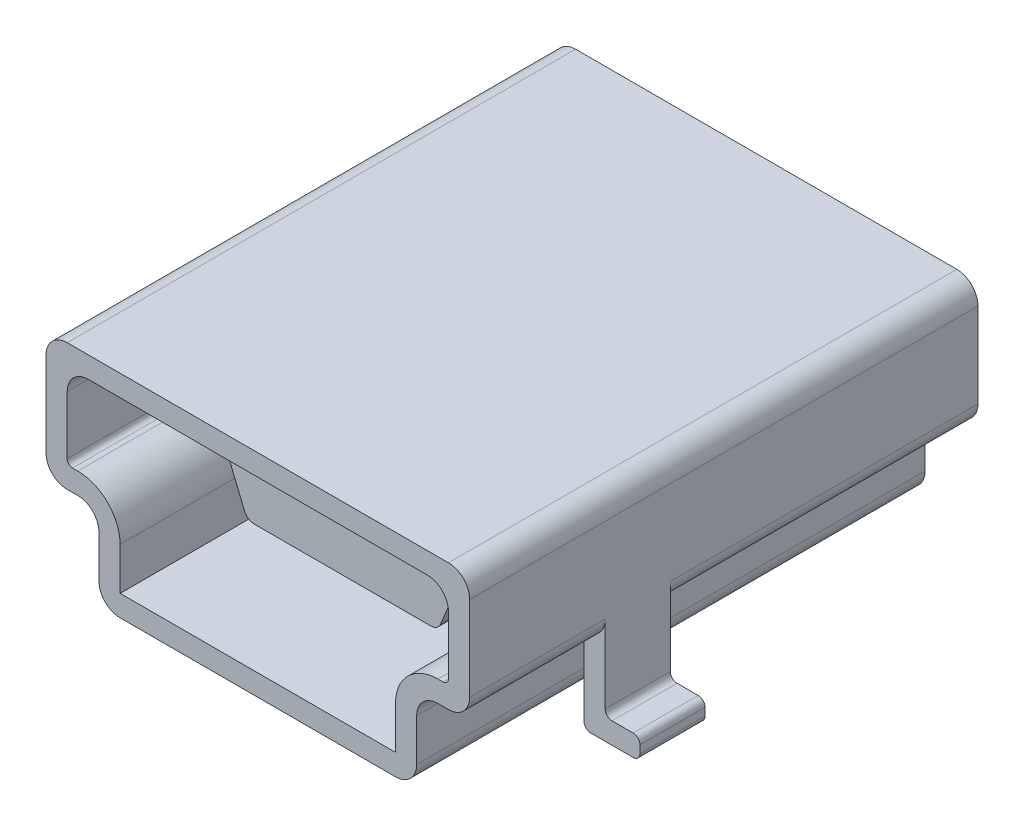
from build123d import *

# Parameters (mm, degrees)
SKETCH1_W           = 7.9375
SKETCH1_H           = 9.525
EXTRUDE1_DEPTH      = 3.96875
SKETCH2_OUTSIDE_W   = 12.541
SKETCH2_OUTSIDE_H   = 8.573
EXTRUDE2_DEPTH      = 14.018467952
EXTRUDE3_DEPTH      = 1.5875
EXTRUDE4_DEPTH      = 6.35
BOSS_EXTRUDE1_START = -2.54
BOSS_EXTRUDE1_DEPTH = 1.2192


with BuildPart() as part:
    # Sketch1 → Extrude1 (new body)
    with BuildSketch(Plane(origin=(0, 0, 0), x_dir=(1, 0, 0), z_dir=(0, 1, 0))):
        with Locations((3.96875, 4.7625)):
            Rectangle(SKETCH1_W, SKETCH1_H)
    extrude(amount=EXTRUDE1_DEPTH)

    # Sketch2 outside → Extrude2 (cut, through all)
    with BuildSketch(Plane.XY):
        with Locations((3.9685, 1.9845)):
            Rectangle(SKETCH2_OUTSIDE_W, SKETCH2_OUTSIDE_H)
        with BuildLine():
            Line((0, 1.984375), (0, 3.571875))
            ThreePointArc((0, 3.571875), (0.116241996, 3.852508004), (0.396875, 3.96875))
            Line((0.396875, 3.96875), (7.540625, 3.96875))
            ThreePointArc((7.540625, 3.96875), (7.821258004, 3.852508004), (7.9375, 3.571875))
            Line((7.9375, 3.571875), (7.9375, 1.984375))
            ThreePointArc((7.9375, 1.984375), (7.821258004, 1.703741996), (7.540625, 1.5875))
            Line((7.540625, 1.5875), (7.3421875, 1.5875))
            ThreePointArc((7.3421875, 1.5875), (7.061554496, 1.471258004), (6.9453125, 1.190625))
            Line((6.9453125, 1.190625), (6.9453125, 0.396875))
            ThreePointArc((6.9453125, 0.396875), (6.829070504, 0.116241996), (6.5484375, 0))
            Line((6.5484375, 0), (1.3890625, 0))
            ThreePointArc((1.3890625, 0), (1.108429496, 0.116241996), (0.9921875, 0.396875))
            Line((0.9921875, 0.396875), (0.9921875, 1.190625))
            ThreePointArc((0.9921875, 1.190625), (0.875945504, 1.471258004), (0.5953125, 1.5875))
            Line((0.5953125, 1.5875), (0.396875, 1.5875))
            ThreePointArc((0.396875, 1.5875), (0.116241996, 1.703741996), (0, 1.984375))
        make_face(mode=Mode.SUBTRACT)
    extrude(amount=-EXTRUDE2_DEPTH, mode=Mode.SUBTRACT)

    # Sketch3 → Extrude3 (cut)
    with BuildSketch(Plane.XY):
        with BuildLine():
            ThreePointArc((1.3890625, 1.190625), (1.156578508, 1.751891008), (0.5953125, 1.984375))
            Line((0.5953125, 1.984375), (0.49609375, 1.984375))
            ThreePointArc((0.49609375, 1.984375), (0.425935499, 2.013435499), (0.396875, 2.08359375))
            Line((0.396875, 2.08359375), (0.396875, 3.175))
            ThreePointArc((0.396875, 3.175), (0.513116996, 3.455633004), (0.79375, 3.571875))
            Line((0.79375, 3.571875), (7.14375, 3.571875))
            ThreePointArc((7.14375, 3.571875), (7.424383004, 3.455633004), (7.540625, 3.175))
            Line((7.540625, 3.175), (7.540625, 2.08359375))
            ThreePointArc((7.540625, 2.08359375), (7.511564501, 2.013435499), (7.44140625, 1.984375))
            Line((7.44140625, 1.984375), (7.3421875, 1.984375))
            ThreePointArc((7.3421875, 1.984375), (6.780921492, 1.751891008), (6.5484375, 1.190625))
            Line((6.5484375, 1.190625), (6.5484375, 0.396875))
            Line((6.5484375, 0.396875), (1.3890625, 0.396875))
            Line((1.3890625, 0.396875), (1.3890625, 1.190625))
        make_face()
    extrude(amount=-EXTRUDE3_DEPTH, mode=Mode.SUBTRACT)

    # Sketch5 → Extrude4 (cut)
    with BuildSketch(Plane.XY.offset(-1.5875)):
        with BuildLine():
            Line((0.79375, 3.571875), (7.14375, 3.571875))
            ThreePointArc((7.14375, 3.571875), (7.424383004, 3.455633004), (7.540625, 3.175))
            Line((7.540625, 3.175), (7.540625, 2.08359375))
            ThreePointArc((7.540625, 2.08359375), (7.511564501, 2.013435499), (7.44140625, 1.984375))
            Line((7.44140625, 1.984375), (7.3421875, 1.984375))
            ThreePointArc((7.3421875, 1.984375), (6.780921492, 1.751891008), (6.5484375, 1.190625))
            Line((6.5484375, 1.190625), (6.5484375, 0.396875))
            Line((6.5484375, 0.396875), (1.3890625, 0.396875))
            Line((1.3890625, 0.396875), (1.3890625, 1.190625))
            ThreePointArc((1.3890625, 1.190625), (1.156578508, 1.751891008), (0.5953125, 1.984375))
            Line((0.5953125, 1.984375), (0.49609375, 1.984375))
            ThreePointArc((0.49609375, 1.984375), (0.425935499, 2.013435499), (0.396875, 2.08359375))
            Line((0.396875, 2.08359375), (0.396875, 3.175))
            ThreePointArc((0.396875, 3.175), (0.513116996, 3.455633004), (0.79375, 3.571875))
        make_face()
        with BuildLine():
            Line((1.824986809, 2.778125), (6.219655485, 2.778125))
            ThreePointArc((6.219655485, 2.778125), (6.29171032, 2.545641008), (6.219655485, 2.313157015))
            Line((6.219655485, 2.313157015), (5.805428146, 1.313123756))
            ThreePointArc((5.805428146, 1.313123756), (5.73234177, 1.224067749), (5.622095802, 1.190625))
            Line((5.622095802, 1.190625), (2.315404198, 1.190625))
            ThreePointArc((2.315404198, 1.190625), (2.20515823, 1.224067749), (2.132071854, 1.313123756))
            Line((2.132071854, 1.313123756), (1.717844515, 2.313157015))
            ThreePointArc((1.717844515, 2.313157015), (1.697050338, 2.562776965), (1.824986809, 2.778125))
        make_face(mode=Mode.SUBTRACT)
    extrude(amount=-EXTRUDE4_DEPTH, mode=Mode.SUBTRACT)

    # Sketch6 → Boss-Extrude1 (add)
    with BuildSketch(Plane.XY.offset(BOSS_EXTRUDE1_START)):
        with BuildLine():
            Line((0, 3.139540901), (0, 0.523875))
            ThreePointArc((0, 0.523875), (-0.037197439, 0.434072439), (-0.127, 0.396875))
            Line((-0.127, 0.396875), (-0.523875, 0.396875))
            ThreePointArc((-0.523875, 0.396875), (-0.613677561, 0.359677561), (-0.650875, 0.269875))
            Line((-0.650875, 0.269875), (-0.650875, 0.127))
            ThreePointArc((-0.650875, 0.127), (-0.613677561, 0.037197439), (-0.523875, 0))
            Line((-0.523875, 0), (0.269875, 0))
            ThreePointArc((0.269875, 0), (0.359677561, 0.037197439), (0.396875, 0.127))
            Line((0.396875, 0.127), (0.396875, 3.139540901))
            Line((0.396875, 3.139540901), (0, 3.139540901))
        make_face()
        with BuildLine():
            Line((7.540625, 3.139540901), (7.9375, 3.139540901))
            Line((7.9375, 3.139540901), (7.9375, 0.523875))
            ThreePointArc((7.9375, 0.523875), (7.974697439, 0.434072439), (8.0645, 0.396875))
            Line((8.0645, 0.396875), (8.461375, 0.396875))
            ThreePointArc((8.461375, 0.396875), (8.551177561, 0.359677561), (8.588375, 0.269875))
            Line((8.588375, 0.269875), (8.588375, 0.127))
            ThreePointArc((8.588375, 0.127), (8.551177561, 0.037197439), (8.461375, 0))
            Line((8.461375, 0), (7.667625, 0))
            ThreePointArc((7.667625, 0), (7.577822439, 0.037197439), (7.540625, 0.127))
            Line((7.540625, 0.127), (7.540625, 3.139540901))
        make_face()
    extrude(amount=-BOSS_EXTRUDE1_DEPTH)


solid = part.part
